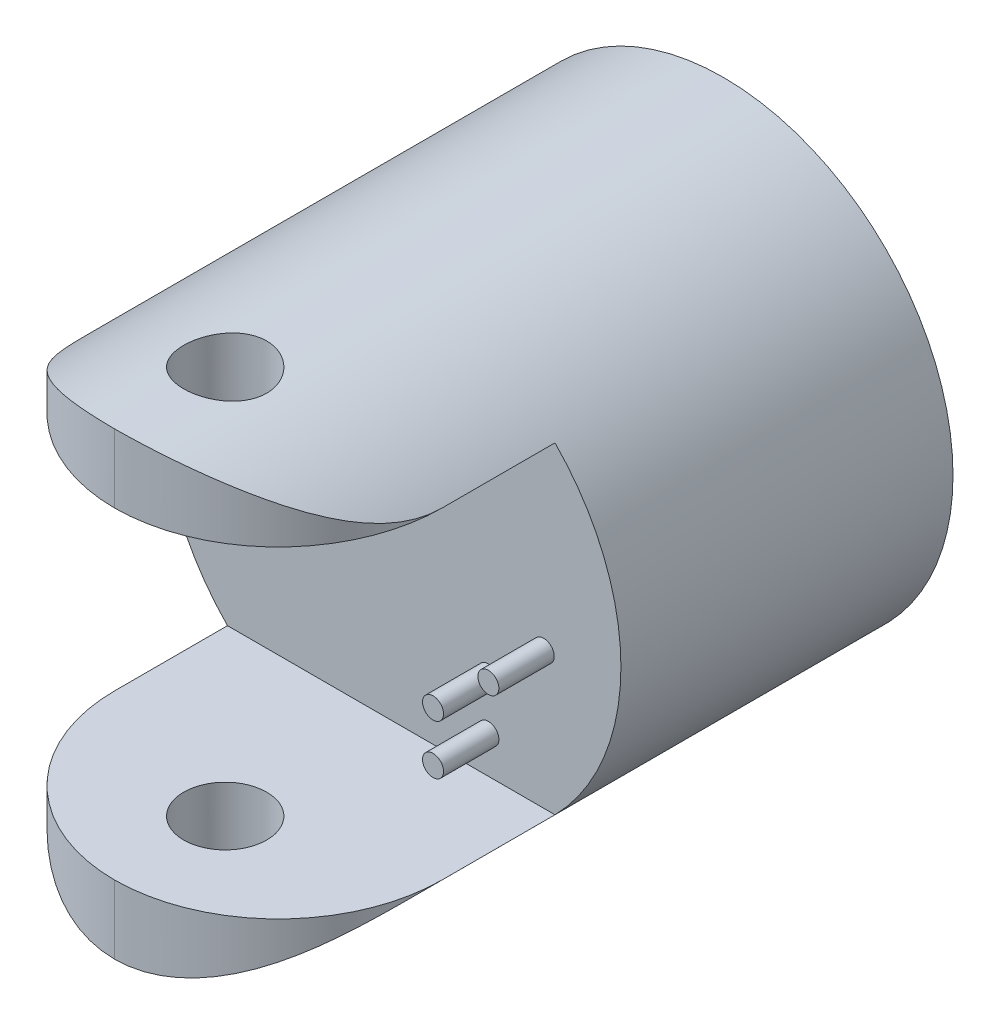
from build123d import *

# Parameters (mm, degrees)
SKETCH1_R               = 4.15
BOSS_EXTRUDE1_DEPTH     = 11
SKETCH2_W               = 8.37511106
SKETCH2_H               = 5.82
CUT_EXTRUDE1_DEPTH      = 5
CUT_EXTRUDE2_DEPTH      = 13.467758419
CUT_EXTRUDE3_DEPTH      = 13.467758574
CUT_EXTRUDE3_DEPTH_BACK = 13.467758574
SKETCH4_R               = 0.75
SKETCH5_R               = 0.19
BOSS_EXTRUDE2_DEPTH     = 1


with BuildPart() as part:
    # Sketch1 → Boss-Extrude1 (new body)
    with BuildSketch(Plane.XY):
        Circle(SKETCH1_R)
    extrude(amount=BOSS_EXTRUDE1_DEPTH)

    # Sketch2 → Cut-Extrude1 (cut)
    with BuildSketch(Plane.XY.offset(11)):
        Rectangle(SKETCH2_W, SKETCH2_H)
    extrude(amount=-CUT_EXTRUDE1_DEPTH, mode=Mode.SUBTRACT)

    # Sketch3 → Cut-Extrude2 (cut, symmetric)
    with BuildSketch(Plane(origin=(0, 0, 0), x_dir=(1, 0, 0), z_dir=(0, 1, 0))):
        with BuildLine():
            Line((-2.958783534, -8.031414478), (-2.958783534, -11))
            Line((-2.958783534, -11), (0, -11))
            ThreePointArc((0, -11), (-2.092768611, -10.127058771), (-2.958783534, -8.031414478))
        make_face()
    cut_extrude2 = extrude(amount=CUT_EXTRUDE2_DEPTH, both=True, mode=Mode.SUBTRACT)

    # Mirror1: Cut-Extrude2 across plane
    add(cut_extrude2.mirror(Plane(origin=(0, 0, 0), x_dir=(0, 0, 1), z_dir=(1, 0, 0))), mode=Mode.SUBTRACT)

    # Sketch4 → Cut-Extrude3 (cut, two sides: drawn at the far end of the back side and taken through both)
    with BuildSketch(Plane(origin=(0, 0, 0), x_dir=(1, 0, 0), z_dir=(0, 1, 0)).offset(-CUT_EXTRUDE3_DEPTH_BACK)):
        with Locations(Location((0, -9, 0), (0, 0, 270))):
            Circle(SKETCH4_R)
    extrude(amount=CUT_EXTRUDE3_DEPTH + CUT_EXTRUDE3_DEPTH_BACK, mode=Mode.SUBTRACT)

    # Sketch5 → Boss-Extrude2 (add)
    with BuildSketch(Plane.XY.offset(6)):
        with Locations((-1.755, 2.26)):
            Circle(SKETCH5_R)
        with Locations((-1.755, 1.36)):
            Circle(SKETCH5_R)
        with Locations((1.755, -1.34)):
            Circle(SKETCH5_R)
        with Locations((1.755, -2.24)):
            Circle(SKETCH5_R)
        with Locations((-2.755, 0.46)):
            Circle(SKETCH5_R)
        with Locations((2.755, -0.44)):
            Circle(SKETCH5_R)
    extrude(amount=BOSS_EXTRUDE2_DEPTH)


solid = part.part
